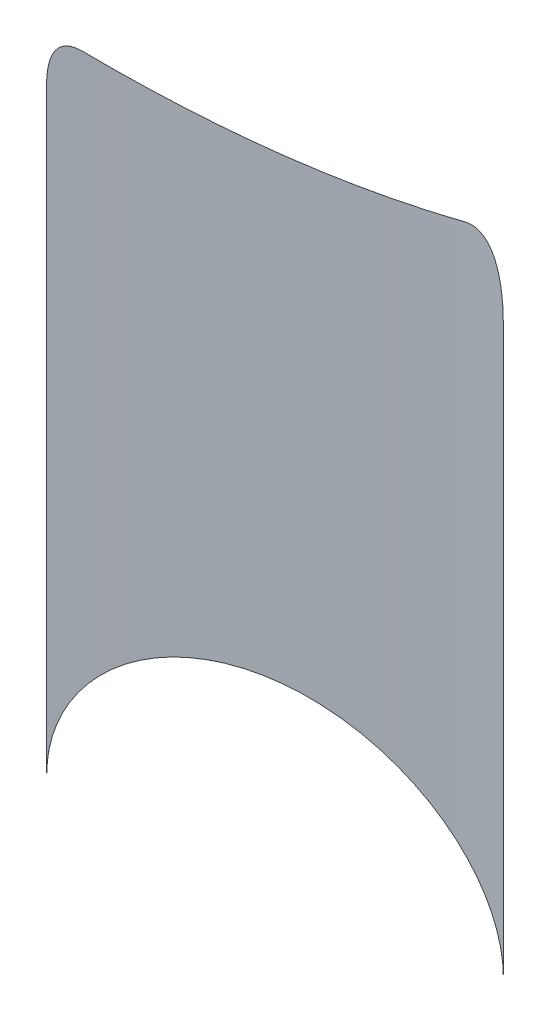
from build123d import *

# Parameters (mm, degrees)
BOSS_EXTRUDE1_DEPTH = 25.4
CUT_EXTRUDE1_REACH  = 30.398
SKETCH2_R           = 6.35
SKETCH4_R           = 83.82
CUT_EXTRUDE3_DEPTH  = 29.398063314
CUT_EXTRUDE4_REACH  = 30.361
FILLET1_R           = 2.54


with BuildPart() as part:
    # Sketch1 → Boss-Extrude1 (new body)
    with BuildSketch(Plane(origin=(0, 0, 0), x_dir=(1, 0, 0), z_dir=(0, 1, 0))):
        Polygon((0, 0), (-8.980256121, -8.980256121), (8.980256121, -8.980256121), align=None)
    extrude(amount=BOSS_EXTRUDE1_DEPTH)

    # Sketch2 → Cut-Extrude1 (cut, up to next)
    with BuildSketch(Plane(origin=(0, 0, 0), x_dir=(-0.7071067811865474, 0, 0.7071067811865477), z_dir=(-0.7071067811865477, 0, -0.7071067811865474)), mode=Mode.PRIVATE) as cut_extrude1_sk1:
        with Locations((6.35, 0)):
            Circle(SKETCH2_R)
    cut_extrude1_tool1 = extrude(cut_extrude1_sk1.sketch, amount=-CUT_EXTRUDE1_REACH, mode=Mode.PRIVATE) & part.part
    add(cut_extrude1_tool1.solids().sort_by_distance((-4.490128, 0, 4.490128))[0], mode=Mode.SUBTRACT)

    # Sketch4 → Cut-Extrude3 (cut, through all)
    with BuildSketch(Plane(origin=(0, 25.4, 0), x_dir=(1, 0, 0), z_dir=(0, 1, 0))):
        with Locations((9.838175311, -90.660480401)):
            Circle(SKETCH4_R)
    extrude(amount=-CUT_EXTRUDE3_DEPTH, mode=Mode.SUBTRACT)

    # Sketch5 → Cut-Extrude4 (cut, up to next)
    with BuildSketch(Plane(origin=(-0.17794868, 0.498418532, -1.352732428), x_dir=(0.9924678045108148, 0.042354141044031964, -0.11495122333366167), z_dir=(0.12250574276124004, -0.3431277622293754, 0.9312656343804265)), mode=Mode.PRIVATE) as cut_extrude4_sk1:
        Polygon((7.123871491, 3.972277825), (-8.869111321, 3.972277825), (-8.869111321, 26.938427805), (7.123871491, 26.216542503), align=None)
    cut_extrude4_tool1 = extrude(cut_extrude4_sk1.sketch, amount=-CUT_EXTRUDE4_REACH, mode=Mode.PRIVATE) & part.part
    add(cut_extrude4_tool1.solids().sort_by_distance((-1.086236, 14.793489, 4.033814))[0], mode=Mode.SUBTRACT)

    # Fillet1
    fillet1_edges = [part.edges().sort_by_distance(p)[0] for p in [
        (3.446132209, 14.816666667, 3.446132209),
        (-4.490128061, 14.816666667, 4.490128061),
    ]]
    fillet(fillet1_edges, radius=FILLET1_R)


solid = part.part
